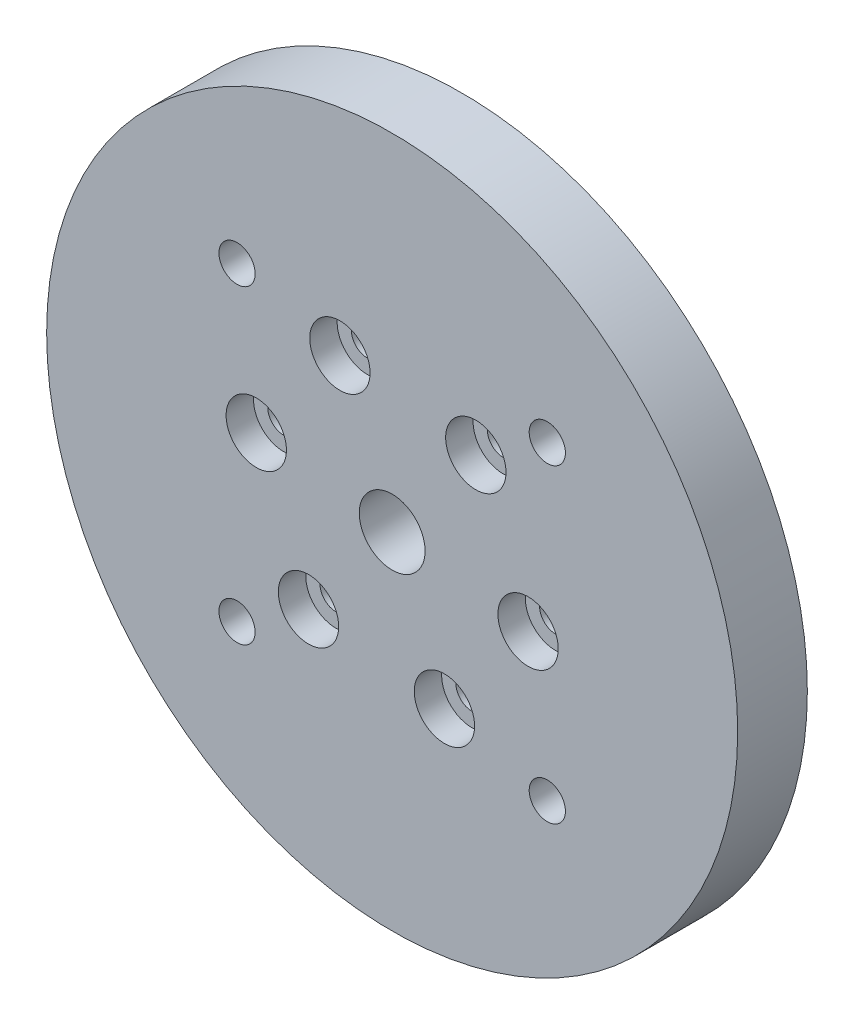
from build123d import *

# Parameters (mm, degrees)
BRIDA_START                  = 567
SK_BRIDA_R                   = 31.5
BRIDA_DEPTH                  = 6.35
CENTRO_START                 = 567
SK_CENTRO_R                  = 3
CENTRO_DEPTH                 = 6.35
ROSCAS_M4_HERRAMIENTA_START  = 567
SK_ROSCAS_M4_HERRAMIENTA_R   = 1.65
ROSCAS_M4_HERRAMIENTA_DEPTH  = 6.35
PASANTES_M2_5_ROTOR_J6_START = 567
SK_PASANTES_M2_5_ROTOR_J6_R  = 1.45
PASANTES_M2_5_ROTOR_J6_DEPTH = 6.35
CAJAS_M2_5_START             = 570.85
SK_CAJAS_M2_5_R              = 2.75
CAJAS_M2_5_DEPTH             = 2.5


with BuildPart() as part:
    # Sk_Brida → Brida (new body)
    with BuildSketch(Plane.XY.offset(BRIDA_START)):
        Circle(SK_BRIDA_R)
    extrude(amount=BRIDA_DEPTH)

    # Sk_Centro → Centro (cut)
    with BuildSketch(Plane.XY.offset(CENTRO_START)):
        Circle(SK_CENTRO_R)
    extrude(amount=CENTRO_DEPTH, mode=Mode.SUBTRACT)

    # Sk_Roscas_M4_herramienta → Roscas_M4_herramienta (cut)
    with BuildSketch(Plane.XY.offset(ROSCAS_M4_HERRAMIENTA_START)):
        with Locations((14.142135624, 14.142135624)):
            Circle(SK_ROSCAS_M4_HERRAMIENTA_R)
        with Locations((-14.142135624, 14.142135624)):
            Circle(SK_ROSCAS_M4_HERRAMIENTA_R)
        with Locations((-14.142135624, -14.142135624)):
            Circle(SK_ROSCAS_M4_HERRAMIENTA_R)
        with Locations((14.142135624, -14.142135624)):
            Circle(SK_ROSCAS_M4_HERRAMIENTA_R)
    extrude(amount=ROSCAS_M4_HERRAMIENTA_DEPTH, mode=Mode.SUBTRACT)

    # Sk_Pasantes_M2-5_rotor_J6 → Pasantes_M2-5_rotor_J6 (cut)
    with BuildSketch(Plane.XY.offset(PASANTES_M2_5_ROTOR_J6_START)):
        with Locations((12.390194253, -1.653204878)):
            Circle(SK_PASANTES_M2_5_ROTOR_J6_R)
        with Locations((7.626814549, 9.903620542)):
            Circle(SK_PASANTES_M2_5_ROTOR_J6_R)
        with Locations((-4.763379704, 11.55682542)):
            Circle(SK_PASANTES_M2_5_ROTOR_J6_R)
        with Locations((-12.390194253, 1.653204878)):
            Circle(SK_PASANTES_M2_5_ROTOR_J6_R)
        with Locations((-7.626814549, -9.903620542)):
            Circle(SK_PASANTES_M2_5_ROTOR_J6_R)
        with Locations((4.763379704, -11.55682542)):
            Circle(SK_PASANTES_M2_5_ROTOR_J6_R)
    extrude(amount=PASANTES_M2_5_ROTOR_J6_DEPTH, mode=Mode.SUBTRACT)

    # Sk_Cajas_M2-5 → Cajas_M2-5 (cut)
    with BuildSketch(Plane.XY.offset(CAJAS_M2_5_START)):
        with Locations((12.390194253, -1.653204878)):
            Circle(SK_CAJAS_M2_5_R)
        with Locations((7.626814549, 9.903620542)):
            Circle(SK_CAJAS_M2_5_R)
        with Locations((-4.763379704, 11.55682542)):
            Circle(SK_CAJAS_M2_5_R)
        with Locations((-12.390194253, 1.653204878)):
            Circle(SK_CAJAS_M2_5_R)
        with Locations((-7.626814549, -9.903620542)):
            Circle(SK_CAJAS_M2_5_R)
        with Locations((4.763379704, -11.55682542)):
            Circle(SK_CAJAS_M2_5_R)
    extrude(amount=CAJAS_M2_5_DEPTH, mode=Mode.SUBTRACT)


solid = part.part
